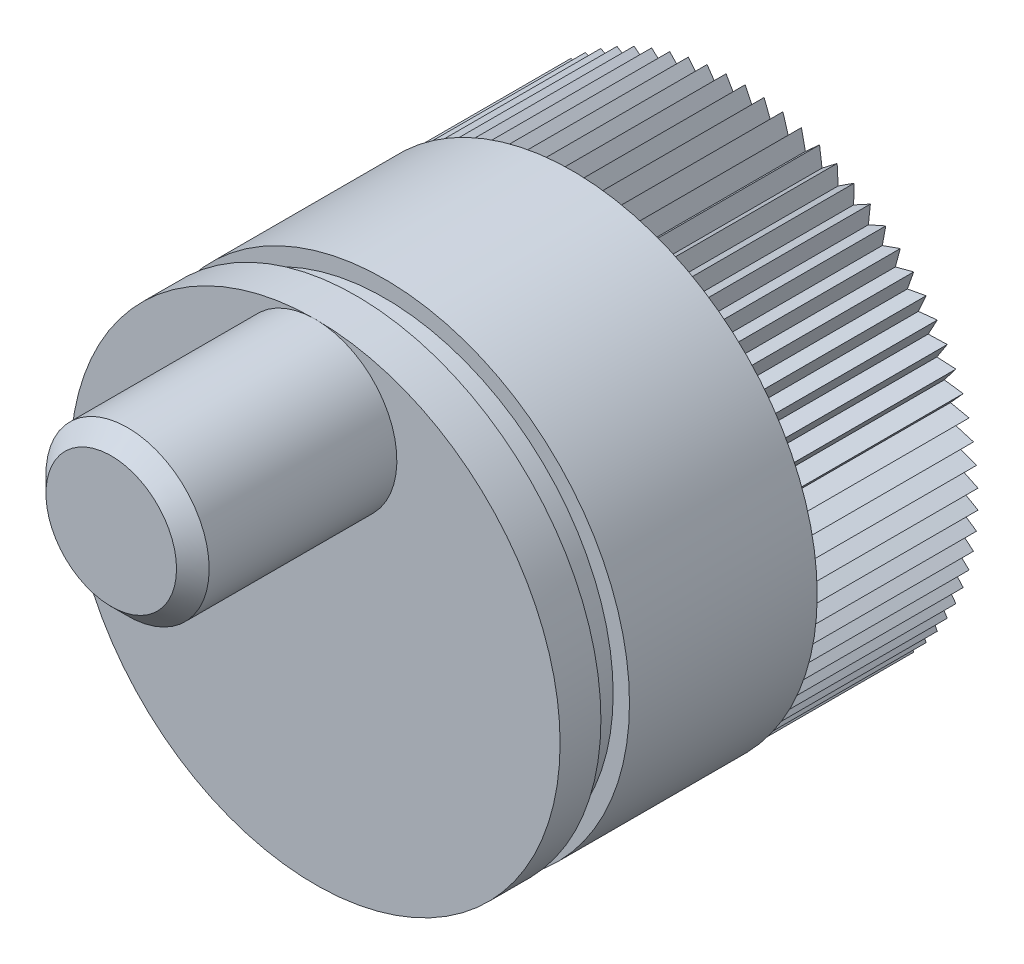
from build123d import *

# Parameters (mm, degrees)
ESQUISSE2_R                  = 2
EXTRUSION1_DEPTH             = 5
CHANFREIN1_SIZE              = 0.4
ENL_V_MAT_EXTRU_1_DEPTH      = 4
R_P_TITION_CIRCULAIRE1_COUNT = 80
R_P_TITION_CIRCULAIRE1_ANGLE = 355.5


with BuildPart() as part:
    # Esquisse1 → Révolution1 (revolve)
    with BuildSketch(Plane(origin=(0, 0, 0), x_dir=(0, 0, -1), z_dir=(1, 0, 0)), mode=Mode.PRIVATE) as r_volution1_sk:
        Polygon((-0.3, 6), (8.3, 6), (8.3, 0), (-2, 0), (-2, 6), (-1, 6), (-1, 5.6), (-0.3, 5.6), align=None)
    revolve(r_volution1_sk.sketch.rotate(Axis((0, 0, 13.12672), (0, 0, -1)), 90), axis=Axis((0, 0, 13.12672), (0, 0, -1)))

    # Esquisse2 → Extrusion1 (add)
    with BuildSketch(Plane.XY.offset(2)):
        with Locations(Location((0, 4, 0), (0, 0, 90))):
            Circle(ESQUISSE2_R)
    extrude(amount=EXTRUSION1_DEPTH)

    # Chanfrein1
    chanfrein1_edges = [part.edges().sort_by_distance(p)[0] for p in [
        (0, 2, 7),
    ]]
    chamfer(chanfrein1_edges, length=CHANFREIN1_SIZE)

    # Esquisse3 → Enlèv. mat.-Extru.1 (cut)
    with BuildSketch(Plane(origin=(0, 0, -8.3), x_dir=(-1, 0, 0), z_dir=(0, 0, -1))):
        Polygon((-0.606501076, 6.586490679), (0, 5.536), (0.672676908, 6.701110581), align=None)
    enl_v_mat_extru_1 = extrude(amount=-ENL_V_MAT_EXTRU_1_DEPTH, mode=Mode.SUBTRACT)

    # Répétition circulaire1: Enlèv. mat.-Extru.1 ×80 about axis
    r_p_tition_circulaire1_axis = Axis((0, 0, 13.12672), (0, 0, -1))
    for i in range(1, R_P_TITION_CIRCULAIRE1_COUNT):
        add(enl_v_mat_extru_1.rotate(r_p_tition_circulaire1_axis, i * R_P_TITION_CIRCULAIRE1_ANGLE / (R_P_TITION_CIRCULAIRE1_COUNT - 1)), mode=Mode.SUBTRACT)


solid = part.part
